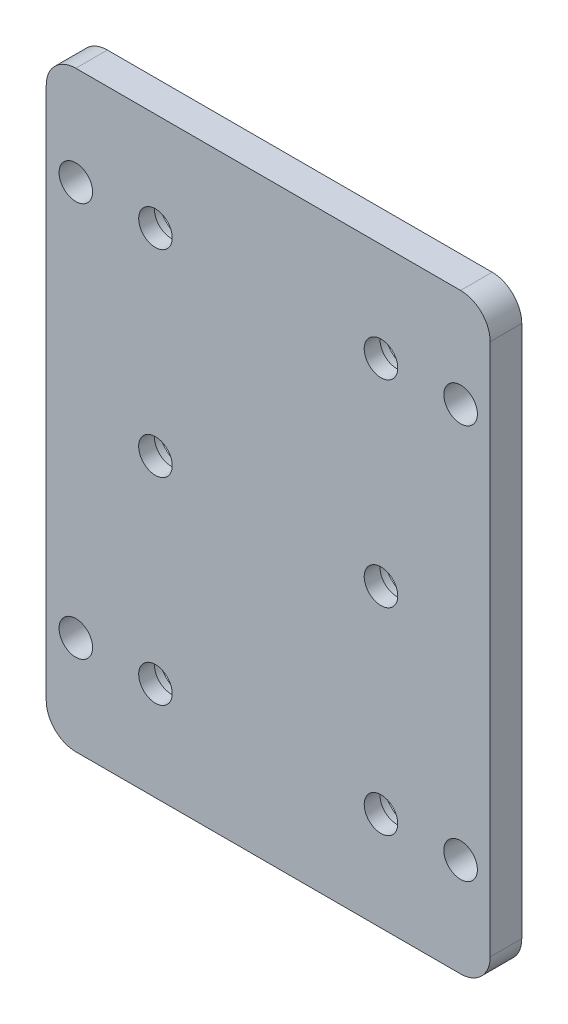
from build123d import *

# Parameters (mm, degrees)
SKETCH_1_W          = 45
SKETCH_1_H          = 60
EXTRUDE_1_DEPTH     = 3.2
SKETCH_3_R          = 1.7
CUT_EXTRUDE_2_DEPTH = 38.636285683
SKETCH_2_R          = 1.7
CUT_EXTRUDE_1_DEPTH = 38.636285683
FILLET_1_R          = 3
SKETCH_4_R          = 3
CUT_EXTRUDE_3_DEPTH = 1.6


with BuildPart() as part:
    # 草圖1 → 填料-伸長1 (new body)
    with BuildSketch(Plane.XY):
        Rectangle(SKETCH_1_W, SKETCH_1_H)
    extrude(amount=EXTRUDE_1_DEPTH)

    # 草圖3 → 除料-伸長2 (cut, through all)
    with BuildSketch(Plane.XY.offset(3.2)):
        with Locations((-11.43, 0)):
            Circle(SKETCH_3_R)
        with Locations((11.43, 0)):
            Circle(SKETCH_3_R)
        with Locations((11.43, 20)):
            Circle(SKETCH_3_R)
        with Locations((-11.43, 20)):
            Circle(SKETCH_3_R)
        with Locations(Location((-11.43, -20, 0), (0, 0, 180))):
            Circle(SKETCH_3_R)
        with Locations(Location((11.43, -20, 0), (0, 0, 180))):
            Circle(SKETCH_3_R)
    extrude(amount=-CUT_EXTRUDE_2_DEPTH, mode=Mode.SUBTRACT)

    # 草圖2 → 除料-伸長1 (cut, through all)
    with BuildSketch(Plane.XY.offset(3.2)):
        with Locations((-19.5, 20)):
            Circle(SKETCH_2_R)
        with Locations((19.5, 20)):
            Circle(SKETCH_2_R)
        with Locations(Location((19.5, -20, 0), (0, 0, 180))):
            Circle(SKETCH_2_R)
        with Locations(Location((-19.5, -20, 0), (0, 0, 180))):
            Circle(SKETCH_2_R)
    extrude(amount=-CUT_EXTRUDE_1_DEPTH, mode=Mode.SUBTRACT)

    # 圓角1
    fillet_1_edges = [part.edges().sort_by_distance(p)[0] for p in [
        (-22.5, 30, 1.6),
        (22.5, 30, 1.6),
        (22.5, -30, 1.6),
        (-22.5, -30, 1.6),
    ]]
    fillet(fillet_1_edges, radius=FILLET_1_R)

    # 草圖4 → 除料-伸長3 (cut)
    with BuildSketch(Plane(origin=(0, 0, 0), x_dir=(-1, 0, 0), z_dir=(0, 0, -1))):
        with Locations((-11.43, 20)):
            Circle(SKETCH_4_R)
        with Locations((11.43, 20)):
            Circle(SKETCH_4_R)
        with Locations((-11.43, 0)):
            Circle(SKETCH_4_R)
        with Locations((11.43, 0)):
            Circle(SKETCH_4_R)
        with Locations((-11.43, -20)):
            Circle(SKETCH_4_R)
        with Locations((11.43, -20)):
            Circle(SKETCH_4_R)
    extrude(amount=-CUT_EXTRUDE_3_DEPTH, mode=Mode.SUBTRACT)


solid = part.part
